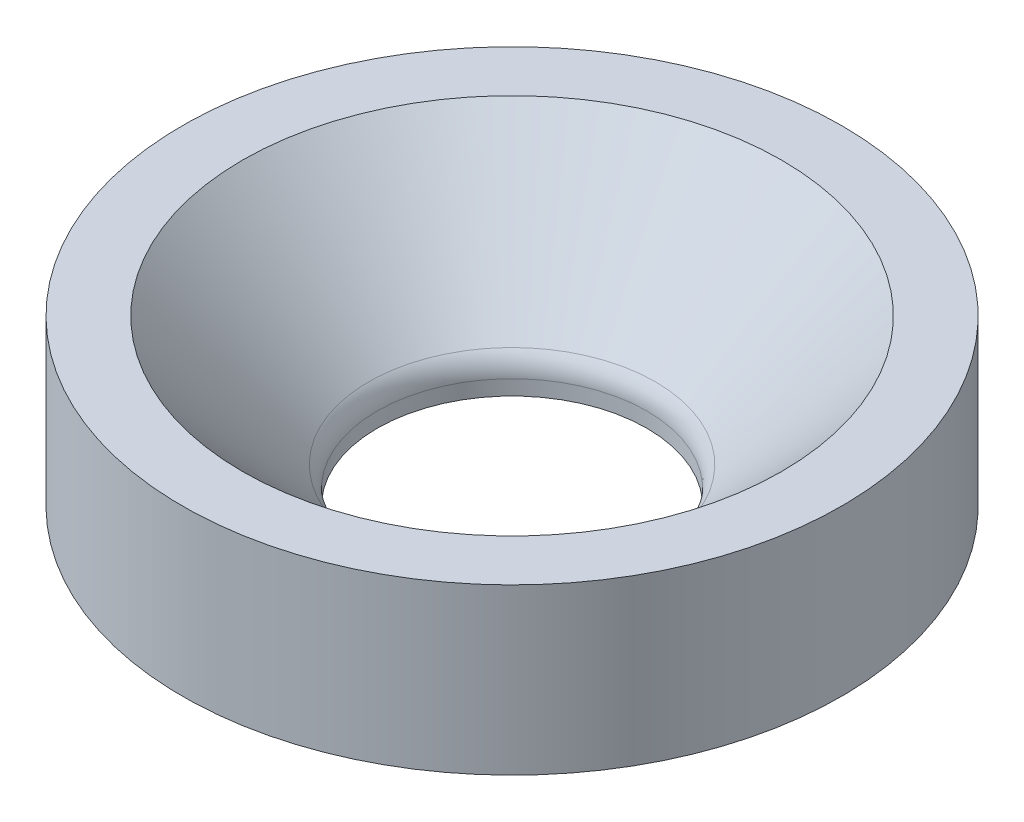
from build123d import *


with BuildPart() as part:
    # Esquisse2 → Révolution1 (revolve)
    with BuildSketch(Plane.XY, mode=Mode.PRIVATE) as r_volution1_sk:
        with BuildLine():
            Line((-9, 0), (-22, 0))
            Line((-22, 0), (-22, 11))
            Line((-22, 11), (-18, 11))
            Line((-18, 11), (-9.571598043, 2.39988137))
            ThreePointArc((-9.571598043, 2.39988137), (-9.148405564, 1.756041033), (-9, 1))
            Line((-9, 1), (-9, 0))
        make_face()
    revolve(r_volution1_sk.sketch.rotate(Axis((0, 0, 0), (0, 1, 0)), 270), axis=Axis((0, 0, 0), (0, 1, 0)))


solid = part.part
